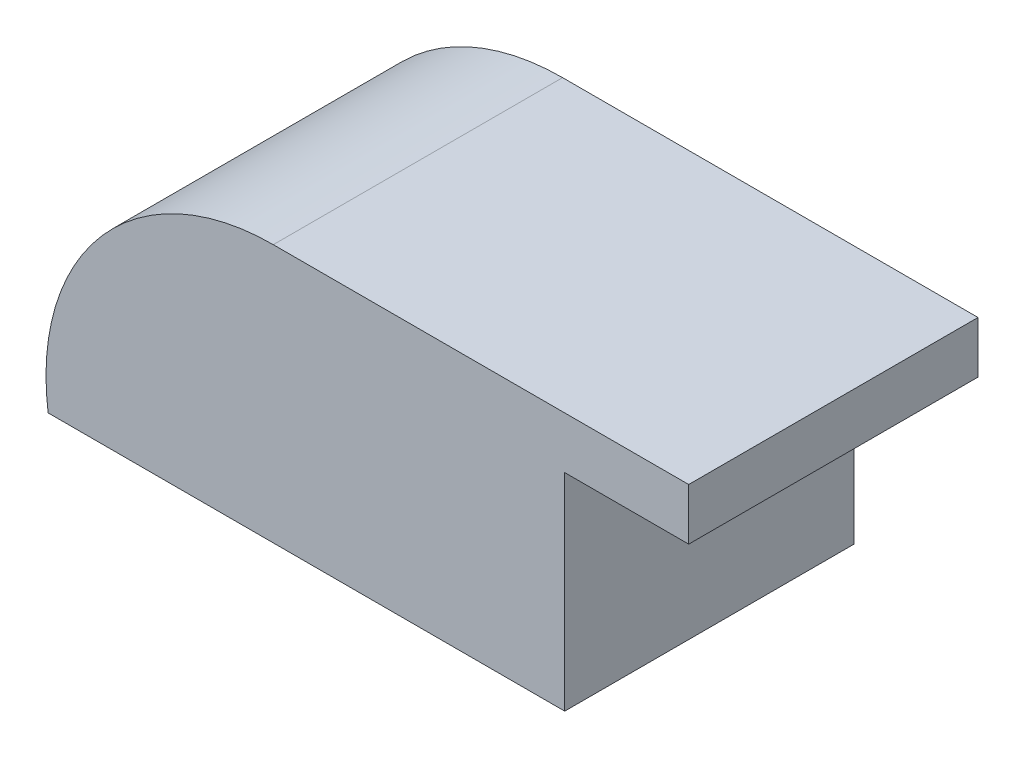
from build123d import *

# Parameters (mm, degrees)
BOSS_EXTRUDE1_DEPTH = 14
SKETCH2_R           = 4
CUT_EXTRUDE1_DEPTH  = 11


with BuildPart() as part:
    # Sketch1 → Boss-Extrude1 (new body)
    with BuildSketch(Plane.XY):
        with BuildLine():
            Line((-8.817662135, -6.081589164), (16.182337865, -6.081589164))
            Line((16.182337865, -6.081589164), (16.182337865, 3.918410836))
            Line((16.182337865, 3.918410836), (22.182337865, 3.918410836))
            Line((22.182337865, 3.918410836), (22.182337865, 6.418410836))
            Line((22.182337865, 6.418410836), (2.079389137, 6.418410836))
            ThreePointArc((2.079389137, 6.418410836), (-6.21204118, 2.646753081), (-8.817662135, -6.081589164))
        make_face()
    extrude(amount=BOSS_EXTRUDE1_DEPTH)

    # Sketch2 → Cut-Extrude1 (cut)
    with BuildSketch(Plane.XZ.offset(6.081589164)):
        with Locations(Location((7.905122548, 7, 0), (0, 0, 270))):
            Circle(SKETCH2_R)
    extrude(amount=-CUT_EXTRUDE1_DEPTH, mode=Mode.SUBTRACT)


solid = part.part
